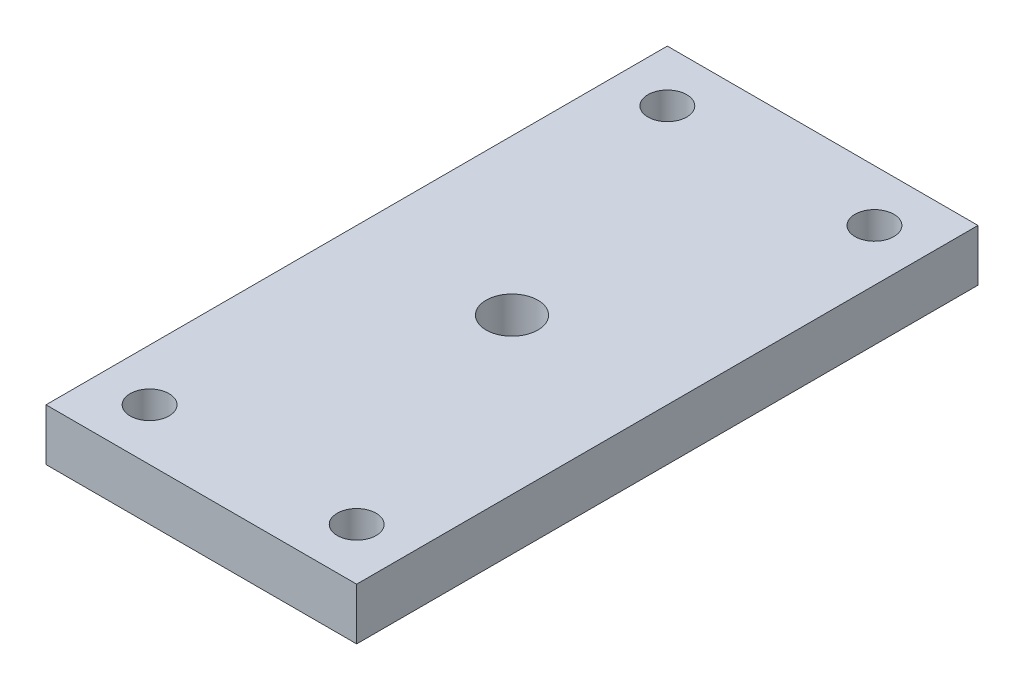
from build123d import *

# Parameters (mm, degrees)
SKETCH1_W           = 76.2
SKETCH1_H           = 152.4
SKETCH1_R           = 6.35
BOSS_EXTRUDE1_DEPTH = 12.7
SKETCH2_R           = 4.7625
CUT_EXTRUDE1_DEPTH  = 87.135590786


with BuildPart() as part:
    # Sketch1 → Boss-Extrude1 (new body)
    with BuildSketch(Plane(origin=(0, 0, 0), x_dir=(1, 0, 0), z_dir=(0, 1, 0))):
        Rectangle(SKETCH1_W, SKETCH1_H)
        with Locations(Location((0, 0, 0), (0, 0, 270))):
            Circle(SKETCH1_R, mode=Mode.SUBTRACT)
    extrude(amount=BOSS_EXTRUDE1_DEPTH)

    # Sketch2 → Cut-Extrude1 (cut, through all)
    with BuildSketch(Plane(origin=(0, 12.7, 0), x_dir=(1, 0, 0), z_dir=(0, 1, 0))):
        with Locations(Location((-25.4, 63.5, 0), (0, 0, 270))):
            Circle(SKETCH2_R)
        with Locations(Location((-25.4, -63.5, 0), (0, 0, 270))):
            Circle(SKETCH2_R)
        with Locations(Location((25.4, -63.5, 0), (0, 0, 270))):
            Circle(SKETCH2_R)
        with Locations(Location((25.4, 63.5, 0), (0, 0, 270))):
            Circle(SKETCH2_R)
    extrude(amount=-CUT_EXTRUDE1_DEPTH, mode=Mode.SUBTRACT)


solid = part.part
